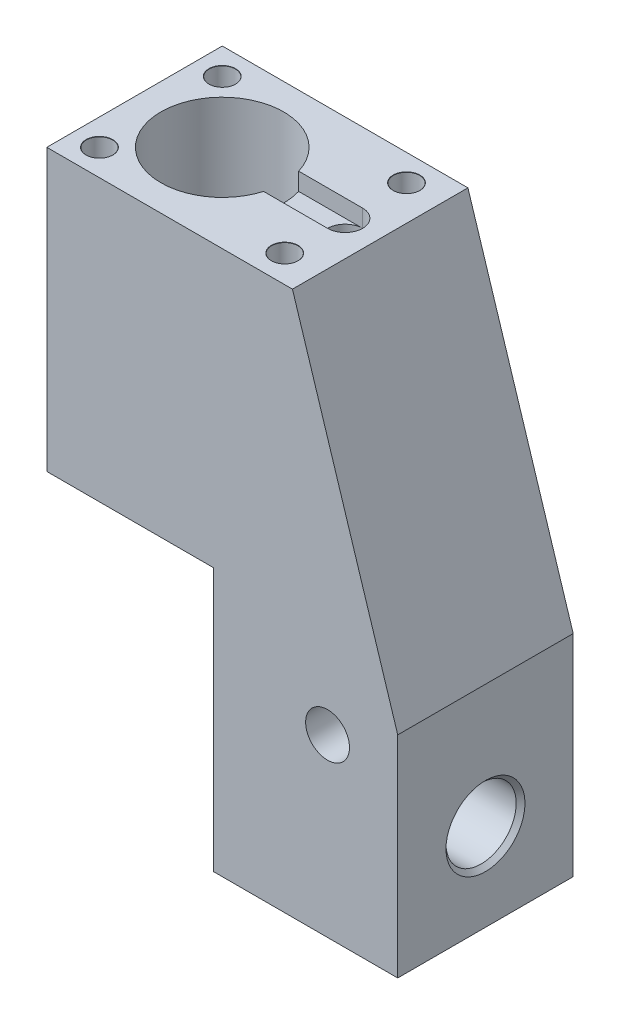
from build123d import *

# Parameters (mm, degrees)
BOSS_EXTRUDE1_DEPTH                  = 10
CUT_EXTRUDE1_REACH                   = 76.458
SKETCH2_R                            = 7
CUT_EXTRUDE2_REACH                   = 76.458
SKETCH5_R                            = 4
CHAMFER1_SIZE                        = 0.5
F_4_2_4_2_DIAMETER_HOLE1_D           = 4.2
F_4_2_4_2_DIAMETER_HOLE1_DEPTH       = 8
F_4_2_4_2_DIAMETER_HOLE1_CSINK_D     = 4.25
F_4_2_4_2_DIAMETER_HOLE1_CSINK_ANGLE = 90
F_4_2_4_2_DIAMETER_HOLE1_TIP         = 1.2618073
CUT_EXTRUDE4_REACH                   = 78.446
SKETCH15_R                           = 2.5
SKETCH6_R                            = 1
CUT_EXTRUDE6_DEPTH                   = 21
CUT_EXTRUDE10_DEPTH                  = 2
SKETCH23_R                           = 1.99826656
CUT_EXTRUDE11_DEPTH                  = 30
SKETCH24_R                           = 1
CUT_EXTRUDE12_DEPTH                  = 51
F_3_0_3_DIAMETER_HOLE2_D             = 3
F_3_0_3_DIAMETER_HOLE2_DEPTH         = 8.098709071
F_3_0_3_DIAMETER_HOLE2_CSINK_D       = 3.05
F_3_0_3_DIAMETER_HOLE2_CSINK_ANGLE   = 90
F_3_0_3_DIAMETER_HOLE2_TIP           = 0.901290929
CUT_EXTRUDE13_REACH                  = 76.458
CUT_EXTRUDE13_END_RADIUS             = 7
SKETCH28_R                           = 1.6


with BuildPart() as part:
    # Sketch1 → Boss-Extrude1 (new, symmetric)
    with BuildSketch(Plane.XY):
        Polygon((0, 0), (28, 0), (40, -38), (40, -62), (19, -62), (19, -32), (0, -32), align=None)
    extrude(amount=BOSS_EXTRUDE1_DEPTH, both=True)

    # Sketch2 → Cut-Extrude1 (cut, up to next)
    with BuildSketch(Plane(origin=(0, 0, 0), x_dir=(1, 0, 0), z_dir=(0, 1, 0)), mode=Mode.PRIVATE) as cut_extrude1_sk1:
        with Locations(Location((10, 0, 0), (0, 0, 270))):
            Circle(SKETCH2_R)
    cut_extrude1_tool1 = extrude(cut_extrude1_sk1.sketch, amount=-CUT_EXTRUDE1_REACH, mode=Mode.PRIVATE) & part.part
    add(cut_extrude1_tool1.solids().sort_by_distance((10, 0, 0))[0], mode=Mode.SUBTRACT)

    # Sketch5 → Cut-Extrude2 (cut, up to next)
    with BuildSketch(Plane(origin=(40, 0, 0), x_dir=(0, 0, -1), z_dir=(1, 0, 0)), mode=Mode.PRIVATE) as cut_extrude2_sk1:
        with Locations((0, -52)):
            Circle(SKETCH5_R)
    cut_extrude2_tool1 = extrude(cut_extrude2_sk1.sketch, amount=-CUT_EXTRUDE2_REACH, mode=Mode.PRIVATE) & part.part
    add(cut_extrude2_tool1.solids().sort_by_distance((40, -52, 0))[0], mode=Mode.SUBTRACT)

    # Chamfer1
    chamfer1_edges = [part.edges().sort_by_distance(p)[0] for p in [
        (40, -52, 4),
    ]]
    chamfer(chamfer1_edges, length=CHAMFER1_SIZE)

    # Ø4.2 (4.2) Diameter Hole1
    with Locations(Plane(origin=(0, -62, 0), x_dir=(-1, 0, 0), z_dir=(0, -1, 0))):
        with Locations((-32, 0), (-24, 0)):
            CounterSinkHole(F_4_2_4_2_DIAMETER_HOLE1_D / 2, F_4_2_4_2_DIAMETER_HOLE1_CSINK_D / 2, depth=F_4_2_4_2_DIAMETER_HOLE1_DEPTH, counter_sink_angle=F_4_2_4_2_DIAMETER_HOLE1_CSINK_ANGLE)
            with Locations((0, 0, -(F_4_2_4_2_DIAMETER_HOLE1_DEPTH + F_4_2_4_2_DIAMETER_HOLE1_TIP / 2))):  # 118° drill point
                Cone(0, F_4_2_4_2_DIAMETER_HOLE1_D / 2, F_4_2_4_2_DIAMETER_HOLE1_TIP, mode=Mode.SUBTRACT)

    # Sketch15 → Cut-Extrude4 (cut, up to next)
    with BuildSketch(Plane.XY.offset(10), mode=Mode.PRIVATE) as cut_extrude4_sk1:
        with Locations((32, -42)):
            Circle(SKETCH15_R)
    cut_extrude4_tool1 = extrude(cut_extrude4_sk1.sketch, amount=-CUT_EXTRUDE4_REACH, mode=Mode.PRIVATE) & part.part
    add(cut_extrude4_tool1.solids().sort_by_distance((32, -42, 10))[0], mode=Mode.SUBTRACT)

    # Sketch6 → Cut-Extrude6 (cut)
    with BuildSketch(Plane.XZ.offset(62)):
        with Locations(Location((32, 0, 0), (0, 0, 270))):
            Circle(SKETCH6_R)
    extrude(amount=-CUT_EXTRUDE6_DEPTH, mode=Mode.SUBTRACT)

    # Sketch22 → Cut-Extrude10 (cut)
    with BuildSketch(Plane(origin=(0, 0, 0), x_dir=(1, 0, 0), z_dir=(0, 1, 0))):
        with BuildLine():
            ThreePointArc((16.708203932, 2), (17, 0), (16.708203932, -2))
            Line((16.708203932, -2), (24, -2))
            ThreePointArc((24, -2), (26, 0), (24, 2))
            Line((24, 2), (16.708203932, 2))
        make_face()
    extrude(amount=-CUT_EXTRUDE10_DEPTH, mode=Mode.SUBTRACT)

    # Sketch23 → Cut-Extrude11 (cut)
    with BuildSketch(Plane(origin=(0, 0, 0), x_dir=(1, 0, 0), z_dir=(0, 1, 0))):
        with Locations(Location((24, 0, 0), (0, 0, 270))):
            Circle(SKETCH23_R)
    extrude(amount=-CUT_EXTRUDE11_DEPTH, mode=Mode.SUBTRACT)

    # Sketch24 → Cut-Extrude12 (cut)
    with BuildSketch(Plane(origin=(0, 0, 0), x_dir=(1, 0, 0), z_dir=(0, 1, 0))):
        with Locations(Location((24, 0, 0), (0, 0, 270))):
            Circle(SKETCH24_R)
    extrude(amount=-CUT_EXTRUDE12_DEPTH, mode=Mode.SUBTRACT)

    # Ø3.0 (3) Diameter Hole2
    with Locations(Plane(origin=(0, 0, 0), x_dir=(1, 0, 0), z_dir=(0, 1, 0))):
        with Locations((24, 7), (24, -6.880303923), (3, -7), (3, 7)):
            CounterSinkHole(F_3_0_3_DIAMETER_HOLE2_D / 2, F_3_0_3_DIAMETER_HOLE2_CSINK_D / 2, depth=F_3_0_3_DIAMETER_HOLE2_DEPTH, counter_sink_angle=F_3_0_3_DIAMETER_HOLE2_CSINK_ANGLE)
            with Locations((0, 0, -(F_3_0_3_DIAMETER_HOLE2_DEPTH + F_3_0_3_DIAMETER_HOLE2_TIP / 2))):  # 118° drill point
                Cone(0, F_3_0_3_DIAMETER_HOLE2_D / 2, F_3_0_3_DIAMETER_HOLE2_TIP, mode=Mode.SUBTRACT)

    # Cut-Extrude13: up to this cylinder (the profile starts outside it)
    cut_extrude13_end = Plane(origin=(10, -17.1005185, 0), z_dir=(0, 1, 0)) * Cylinder(CUT_EXTRUDE13_END_RADIUS, 168.117037, mode=Mode.PRIVATE)
    # Sketch28 → Cut-Extrude13 (cut, up to the surface)
    with BuildSketch(Plane.ZY, mode=Mode.PRIVATE) as cut_extrude13_sk1:
        with Locations((-3, -17)):
            Circle(SKETCH28_R)
    cut_extrude13_tool1 = extrude(cut_extrude13_sk1.sketch, amount=-CUT_EXTRUDE13_REACH, mode=Mode.PRIVATE) - cut_extrude13_end
    add(cut_extrude13_tool1.solids().sort_by_distance((0, -17, -3))[0], mode=Mode.SUBTRACT)
    # Sketch28 → Cut-Extrude13 (cut, up to the surface)
    with BuildSketch(Plane.ZY, mode=Mode.PRIVATE) as cut_extrude13_sk2:
        with Locations((3, -17.201037224)):
            Circle(SKETCH28_R)
    cut_extrude13_tool2 = extrude(cut_extrude13_sk2.sketch, amount=-CUT_EXTRUDE13_REACH, mode=Mode.PRIVATE) - cut_extrude13_end
    add(cut_extrude13_tool2.solids().sort_by_distance((0, -17.201037, 3))[0], mode=Mode.SUBTRACT)


solid = part.part
